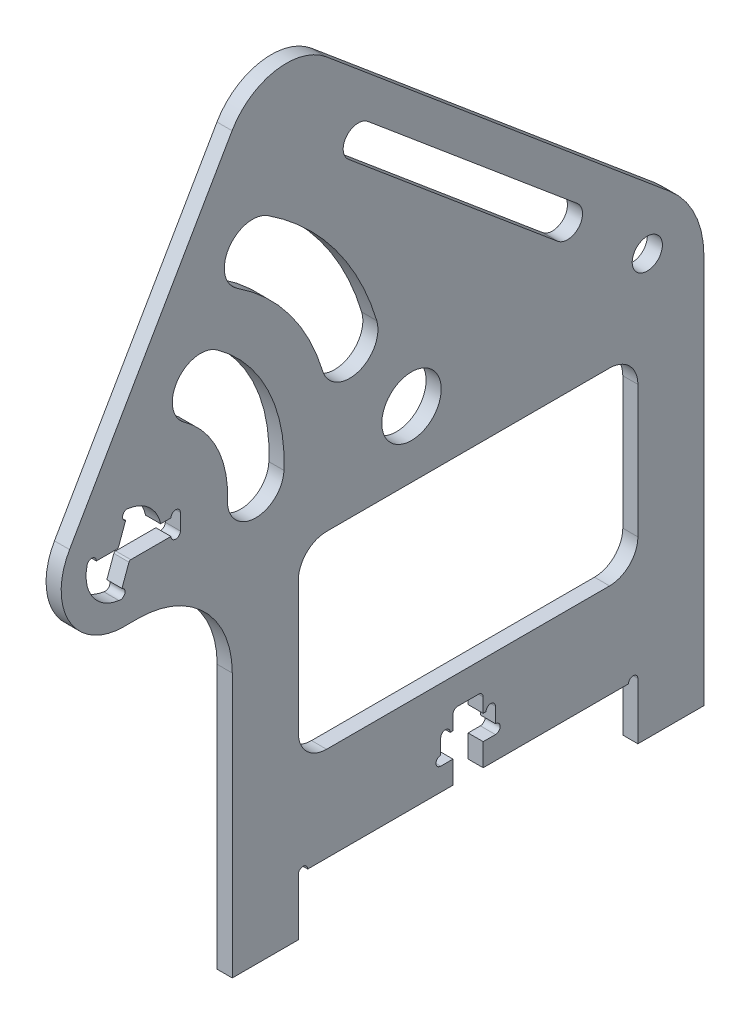
from build123d import *

# Parameters (mm, degrees)
MAIN_BODY_DEPTH                     = 0.8
SLOT_TABS_REACH                     = 94.146
SKETCH2_W                           = 7
SKETCH2_H                           = 6
SLOT_TABS_DIRECTION_2_REACH         = 94.146
ATTACHMENT_T_SLOT_DEPTH             = 93.146279065
ATTACHMENT_T_SLOT_DEPTH_BACK        = 93.146279065
SKETCH5_R                           = 1.6
CAMERA_SLOT_AND_STANDOFF_HOLE_DEPTH = 93.156696694
SKETCH6_R                           = 4
CAMERA_PLATE_HOLE_DEPTH             = 93.156696694
SKETCH9_W                           = 4
SKETCH9_H                           = 1.7
CAMERA_PLATE_SLOT_DEPTH             = 93.156696694
ANGLE_GUARD_DEPTH                   = 1.6
SKETCH7_W                           = 36
SKETCH7_H                           = 20
CUT_EXTRUDE4_DEPTH                  = 93.156696694
CAMERA_PLATE_HOLE_EASE_R            = 0.2
ACCESS_HOLE_FILLET_R                = 3
SECONDARY_FILLET_R                  = 10
CAMERA_EDGE_FILLET_R                = 6.639528096
SKETCH8_R                           = 3.15
TX_MOUNT_HOLE_DEPTH                 = 87.640768077
CUT_EXTRUDE5_REACH                  = 88.641
SKETCH14_R                          = 0.5
CUT_EXTRUDE6_REACH                  = 88.641


with BuildPart() as part:
    # Sketch1 → main body (new, symmetric)
    with BuildSketch(Plane(origin=(0, 0, 0), x_dir=(0, 0, -1), z_dir=(1, 0, 0))):
        Polygon((-25, 0), (25, 0), (25, 40), (-21.064869316, 78.653014853), (-48, 32), (-25, 32), align=None)
    extrude(amount=MAIN_BODY_DEPTH, both=True)

    # slot tabs: up to this face of the body (flat: up to its plane)
    slot_tabs_end = Plane(part.part.faces().sort_by_distance((0.8, 33.215216507, 6.663009482))[0])
    # Sketch2 → slot tabs (add, up to the picked face)
    with BuildSketch(Plane(origin=(0, 0, 0), x_dir=(0, 0, -1), z_dir=(1, 0, 0)), mode=Mode.PRIVATE) as slot_tabs_sk1:
        with Locations((-21.5, -3)):
            Rectangle(SKETCH2_W, SKETCH2_H)
    slot_tabs_tool1 = split(extrude(slot_tabs_sk1.sketch, amount=SLOT_TABS_REACH, mode=Mode.PRIVATE), bisect_by=slot_tabs_end, keep=Keep.BOTH, mode=Mode.PRIVATE)
    # Sketch2 → slot tabs (add, up to the picked face)
    with BuildSketch(Plane(origin=(0, 0, 0), x_dir=(0, 0, -1), z_dir=(1, 0, 0)), mode=Mode.PRIVATE) as slot_tabs_sk2:
        with Locations((21.5, -3)):
            Rectangle(SKETCH2_W, SKETCH2_H)
    slot_tabs_tool2 = split(extrude(slot_tabs_sk2.sketch, amount=SLOT_TABS_REACH, mode=Mode.PRIVATE), bisect_by=slot_tabs_end, keep=Keep.BOTH, mode=Mode.PRIVATE)
    add(slot_tabs_tool1.solids().sort_by(Axis((0, -3, 21.5), (1, 0, 0)))[0])
    add(slot_tabs_tool2.solids().sort_by(Axis((0, -3, -21.5), (1, 0, 0)))[0])

    # slot tabs direction 2: up to this face of the body (flat: up to its plane)
    slot_tabs_direction_2_end = Plane(part.part.faces().sort_by_distance((-0.8, 33.215216507, 6.663009482))[0])
    # Sketch2 → slot tabs direction 2 (add, up to the picked face)
    with BuildSketch(Plane(origin=(0, 0, 0), x_dir=(0, 0, -1), z_dir=(1, 0, 0)), mode=Mode.PRIVATE) as slot_tabs_direction_2_sk1:
        with Locations((-21.5, -3)):
            Rectangle(SKETCH2_W, SKETCH2_H)
    slot_tabs_direction_2_tool1 = split(extrude(slot_tabs_direction_2_sk1.sketch, amount=-SLOT_TABS_DIRECTION_2_REACH, mode=Mode.PRIVATE), bisect_by=slot_tabs_direction_2_end, keep=Keep.BOTH, mode=Mode.PRIVATE)
    # Sketch2 → slot tabs direction 2 (add, up to the picked face)
    with BuildSketch(Plane(origin=(0, 0, 0), x_dir=(0, 0, -1), z_dir=(1, 0, 0)), mode=Mode.PRIVATE) as slot_tabs_direction_2_sk2:
        with Locations((21.5, -3)):
            Rectangle(SKETCH2_W, SKETCH2_H)
    slot_tabs_direction_2_tool2 = split(extrude(slot_tabs_direction_2_sk2.sketch, amount=-SLOT_TABS_DIRECTION_2_REACH, mode=Mode.PRIVATE), bisect_by=slot_tabs_direction_2_end, keep=Keep.BOTH, mode=Mode.PRIVATE)
    add(slot_tabs_direction_2_tool1.solids().sort_by(Axis((0, -3, 21.5), (-1, 0, 0)))[0])
    add(slot_tabs_direction_2_tool2.solids().sort_by(Axis((0, -3, -21.5), (-1, 0, 0)))[0])

    # Sketch3 → attachment t-slot (cut, two sides: drawn at the far end of the back side and taken through both)
    with BuildSketch(Plane(origin=(0, 0, 0), x_dir=(0, 0, -1), z_dir=(1, 0, 0)).offset(-ATTACHMENT_T_SLOT_DEPTH_BACK)):
        Polygon((-1.6, 2.4), (-1.6, 0), (1.6, 0), (1.6, 2.4), (2.9, 2.4), (2.9, 5), (-2.9, 5), (-2.9, 2.4), align=None)
    extrude(amount=ATTACHMENT_T_SLOT_DEPTH + ATTACHMENT_T_SLOT_DEPTH_BACK, mode=Mode.SUBTRACT)

    # Sketch5 → camera slot and standoff hole (cut, through all)
    with BuildSketch(Plane(origin=(0.8, 0, 0), x_dir=(0, 0, -1), z_dir=(1, 0, 0))):
        with Locations((19, 38.50756134)):
            Circle(SKETCH5_R)
        with BuildLine():
            Line((-10.613317549, 65.444736837), (11.562427184, 46.83707761))
            ThreePointArc((11.562427184, 46.83707761), (11.759638118, 44.582946325), (9.505506833, 44.385735392))
            Line((9.505506833, 44.385735392), (-12.6702379, 62.993394619))
            ThreePointArc((-12.6702379, 62.993394619), (-12.867448834, 65.247525903), (-10.613317549, 65.444736837))
        make_face()
    extrude(amount=-CAMERA_SLOT_AND_STANDOFF_HOLE_DEPTH, mode=Mode.SUBTRACT)

    # Sketch6 → camera plate hole (cut, through all)
    with BuildSketch(Plane(origin=(0.8, 0, 0), x_dir=(0, 0, -1), z_dir=(1, 0, 0))):
        with Locations((-36.5, 38.639528096)):
            Circle(SKETCH6_R)
    extrude(amount=-CAMERA_PLATE_HOLE_DEPTH, mode=Mode.SUBTRACT)

    # Sketch9 → camera plate slot (cut, through all)
    with BuildSketch(Plane(origin=(0.8, 0, 0), x_dir=(0, 0, -1), z_dir=(1, 0, 0))):
        with Locations((-32.5, 38.639528096)):
            Rectangle(SKETCH9_W, SKETCH9_H)
    extrude(amount=-CAMERA_PLATE_SLOT_DEPTH, mode=Mode.SUBTRACT)

    # Sketch11 → angle guard (add)
    with BuildSketch(Plane(origin=(0.8, 0, 0), x_dir=(0, 0, -1), z_dir=(1, 0, 0))):
        with BuildLine():
            Line((-40.408644266, 39.489528096), (-37.095176407, 39.489528096))
            Line((-37.095176407, 39.489528096), (-35.961903656, 42.603169392))
            ThreePointArc((-35.961903656, 42.603169392), (-38.794305745, 41.916136273), (-40.408644266, 39.489528096))
        make_face()
        with BuildLine():
            ThreePointArc((-37.038096344, 34.6758868), (-34.205694255, 35.362919919), (-32.591355734, 37.789528096))
            Line((-32.591355734, 37.789528096), (-35.904823593, 37.789528096))
            Line((-35.904823593, 37.789528096), (-37.038096344, 34.6758868))
        make_face()
    extrude(amount=-ANGLE_GUARD_DEPTH)

    # Sketch7 → Cut-Extrude4 (cut, through all)
    with BuildSketch(Plane(origin=(0.8, 0, 0), x_dir=(0, 0, -1), z_dir=(1, 0, 0))):
        with Locations((0, 20)):
            Rectangle(SKETCH7_W, SKETCH7_H)
    extrude(amount=-CUT_EXTRUDE4_DEPTH, mode=Mode.SUBTRACT)

    # camera plate hole ease
    camera_plate_hole_ease_edges = [part.edges().sort_by_distance(p)[0] for p in [
        (0, 39.489528096, 37.095176407),
        (0, 37.789528096, 35.904823593),
    ]]
    fillet(camera_plate_hole_ease_edges, radius=CAMERA_PLATE_HOLE_EASE_R)

    # access hole fillet
    access_hole_fillet_edges = [part.edges().sort_by_distance(p)[0] for p in [
        (0, 10, 18),
        (0, 30, 18),
        (0, 30, -18),
        (0, 10, -18),
    ]]
    fillet(access_hole_fillet_edges, radius=ACCESS_HOLE_FILLET_R)

    # secondary fillet
    secondary_fillet_edges = [part.edges().sort_by_distance(p)[0] for p in [
        (0, 32, 25),
        (0, 40, -25),
    ]]
    fillet(secondary_fillet_edges, radius=SECONDARY_FILLET_R)

    # camera edge fillet
    camera_edge_fillet_edges = [part.edges().sort_by_distance(p)[0] for p in [
        (0, 32, 48),
        (0, 78.653014853, 21.064869316),
    ]]
    fillet(camera_edge_fillet_edges, radius=CAMERA_EDGE_FILLET_R)

    # Sketch8 → TX mount hole (cut, through all)
    with BuildSketch(Plane(origin=(0.8, 0, 0), x_dir=(0, 0, -1), z_dir=(1, 0, 0))):
        with Locations((-6, 37)):
            Circle(SKETCH8_R)
    extrude(amount=-TX_MOUNT_HOLE_DEPTH, mode=Mode.SUBTRACT)

    # Sketch14 → Cut-Extrude5 (cut, up to next)
    with BuildSketch(Plane(origin=(0.8, 0, 0), x_dir=(0, 0, -1), z_dir=(1, 0, 0)), mode=Mode.PRIVATE) as cut_extrude5_sk1:
        with Locations((-2.4, 5)):
            Circle(SKETCH14_R)
    cut_extrude5_tool1 = extrude(cut_extrude5_sk1.sketch, amount=-CUT_EXTRUDE5_REACH, mode=Mode.PRIVATE) & part.part
    # Sketch14 → Cut-Extrude5 (cut, up to next)
    with BuildSketch(Plane(origin=(0.8, 0, 0), x_dir=(0, 0, -1), z_dir=(1, 0, 0)), mode=Mode.PRIVATE) as cut_extrude5_sk2:
        with Locations((2.4, 5)):
            Circle(SKETCH14_R)
    cut_extrude5_tool2 = extrude(cut_extrude5_sk2.sketch, amount=-CUT_EXTRUDE5_REACH, mode=Mode.PRIVATE) & part.part
    # Sketch14 → Cut-Extrude5 (cut, up to next)
    with BuildSketch(Plane(origin=(0.8, 0, 0), x_dir=(0, 0, -1), z_dir=(1, 0, 0)), mode=Mode.PRIVATE) as cut_extrude5_sk3:
        with Locations((2.9, 2.9)):
            Circle(SKETCH14_R)
    cut_extrude5_tool3 = extrude(cut_extrude5_sk3.sketch, amount=-CUT_EXTRUDE5_REACH, mode=Mode.PRIVATE) & part.part
    # Sketch14 → Cut-Extrude5 (cut, up to next)
    with BuildSketch(Plane(origin=(0.8, 0, 0), x_dir=(0, 0, -1), z_dir=(1, 0, 0)), mode=Mode.PRIVATE) as cut_extrude5_sk4:
        with Locations((-2.9, 2.9)):
            Circle(SKETCH14_R)
    cut_extrude5_tool4 = extrude(cut_extrude5_sk4.sketch, amount=-CUT_EXTRUDE5_REACH, mode=Mode.PRIVATE) & part.part
    # Sketch14 → Cut-Extrude5 (cut, up to next)
    with BuildSketch(Plane(origin=(0.8, 0, 0), x_dir=(0, 0, -1), z_dir=(1, 0, 0)), mode=Mode.PRIVATE) as cut_extrude5_sk5:
        with Locations((-17.5, 0)):
            Circle(SKETCH14_R)
    cut_extrude5_tool5 = extrude(cut_extrude5_sk5.sketch, amount=-CUT_EXTRUDE5_REACH, mode=Mode.PRIVATE) & part.part
    # Sketch14 → Cut-Extrude5 (cut, up to next)
    with BuildSketch(Plane(origin=(0.8, 0, 0), x_dir=(0, 0, -1), z_dir=(1, 0, 0)), mode=Mode.PRIVATE) as cut_extrude5_sk6:
        with Locations((17.5, 0)):
            Circle(SKETCH14_R)
    cut_extrude5_tool6 = extrude(cut_extrude5_sk6.sketch, amount=-CUT_EXTRUDE5_REACH, mode=Mode.PRIVATE) & part.part
    # Sketch14 → Cut-Extrude5 (cut, up to next)
    with BuildSketch(Plane(origin=(0.8, 0, 0), x_dir=(0, 0, -1), z_dir=(1, 0, 0)), mode=Mode.PRIVATE) as cut_extrude5_sk7:
        with Locations((-36.132913727, 42.133323081)):
            Circle(SKETCH14_R)
    cut_extrude5_tool7 = extrude(cut_extrude5_sk7.sketch, amount=-CUT_EXTRUDE5_REACH, mode=Mode.PRIVATE) & part.part
    # Sketch14 → Cut-Extrude5 (cut, up to next)
    with BuildSketch(Plane(origin=(0.8, 0, 0), x_dir=(0, 0, -1), z_dir=(1, 0, 0)), mode=Mode.PRIVATE) as cut_extrude5_sk8:
        with Locations((-39.908644266, 39.489528096)):
            Circle(SKETCH14_R)
    cut_extrude5_tool8 = extrude(cut_extrude5_sk8.sketch, amount=-CUT_EXTRUDE5_REACH, mode=Mode.PRIVATE) & part.part
    # Sketch14 → Cut-Extrude5 (cut, up to next)
    with BuildSketch(Plane(origin=(0.8, 0, 0), x_dir=(0, 0, -1), z_dir=(1, 0, 0)), mode=Mode.PRIVATE) as cut_extrude5_sk9:
        with Locations((-36.867086273, 35.14573311)):
            Circle(SKETCH14_R)
    cut_extrude5_tool9 = extrude(cut_extrude5_sk9.sketch, amount=-CUT_EXTRUDE5_REACH, mode=Mode.PRIVATE) & part.part
    # Sketch14 → Cut-Extrude5 (cut, up to next)
    with BuildSketch(Plane(origin=(0.8, 0, 0), x_dir=(0, 0, -1), z_dir=(1, 0, 0)), mode=Mode.PRIVATE) as cut_extrude5_sk10:
        with Locations((-31, 37.789528096)):
            Circle(SKETCH14_R)
    cut_extrude5_tool10 = extrude(cut_extrude5_sk10.sketch, amount=-CUT_EXTRUDE5_REACH, mode=Mode.PRIVATE) & part.part
    # Sketch14 → Cut-Extrude5 (cut, up to next)
    with BuildSketch(Plane(origin=(0.8, 0, 0), x_dir=(0, 0, -1), z_dir=(1, 0, 0)), mode=Mode.PRIVATE) as cut_extrude5_sk11:
        with Locations((-31, 39.489528096)):
            Circle(SKETCH14_R)
    cut_extrude5_tool11 = extrude(cut_extrude5_sk11.sketch, amount=-CUT_EXTRUDE5_REACH, mode=Mode.PRIVATE) & part.part
    # Sketch14 → Cut-Extrude5 (cut, up to next)
    with BuildSketch(Plane(origin=(0.8, 0, 0), x_dir=(0, 0, -1), z_dir=(1, 0, 0)), mode=Mode.PRIVATE) as cut_extrude5_sk12:
        with BuildLine():
            Line((-1.1, 7), (1.1, 7))
            ThreePointArc((1.1, 7), (1.453553391, 6.853553391), (1.6, 6.5))
            Line((1.6, 6.5), (1.6, 5))
            ThreePointArc((1.6, 5), (0, 3.4), (-1.6, 5))
            Line((-1.6, 5), (-1.6, 6.5))
            ThreePointArc((-1.6, 6.5), (-1.453553391, 6.853553391), (-1.1, 7))
        make_face()
    cut_extrude5_tool12 = extrude(cut_extrude5_sk12.sketch, amount=-CUT_EXTRUDE5_REACH, mode=Mode.PRIVATE) & part.part
    add(cut_extrude5_tool1.solids().sort_by_distance((0.8, 5, 2.4))[0], mode=Mode.SUBTRACT)
    add(cut_extrude5_tool2.solids().sort_by_distance((0.8, 5, -2.4))[0], mode=Mode.SUBTRACT)
    add(cut_extrude5_tool3.solids().sort_by_distance((0.8, 2.9, -2.9))[0], mode=Mode.SUBTRACT)
    add(cut_extrude5_tool4.solids().sort_by_distance((0.8, 2.9, 2.9))[0], mode=Mode.SUBTRACT)
    add(cut_extrude5_tool5.solids().sort_by_distance((0.8, 0, 17.5))[0], mode=Mode.SUBTRACT)
    add(cut_extrude5_tool6.solids().sort_by_distance((0.8, 0, -17.5))[0], mode=Mode.SUBTRACT)
    add(cut_extrude5_tool7.solids().sort_by_distance((0.8, 42.133323, 36.132914))[0], mode=Mode.SUBTRACT)
    add(cut_extrude5_tool8.solids().sort_by_distance((0.8, 39.489528, 39.908644))[0], mode=Mode.SUBTRACT)
    add(cut_extrude5_tool9.solids().sort_by_distance((0.8, 35.145733, 36.867086))[0], mode=Mode.SUBTRACT)
    add(cut_extrude5_tool10.solids().sort_by_distance((0.8, 37.789528, 31))[0], mode=Mode.SUBTRACT)
    add(cut_extrude5_tool11.solids().sort_by_distance((0.8, 39.489528, 31))[0], mode=Mode.SUBTRACT)
    add(cut_extrude5_tool12.solids().sort_by_distance((0.8, 5.336119, 0))[0], mode=Mode.SUBTRACT)

    # Sketch15 → Cut-Extrude6 (cut, up to next)
    with BuildSketch(Plane(origin=(0.8, 0, 0), x_dir=(0, 0, -1), z_dir=(1, 0, 0)), mode=Mode.PRIVATE) as cut_extrude6_sk1:
        with BuildLine():
            ThreePointArc((-19.517746342, 37.862958265), (-21.207853248, 46.065849373), (-26.609553808, 52.466280213))
            ThreePointArc((-26.609553808, 52.466280213), (-30.794941745, 51.771637991), (-30.100299523, 47.586250054))
            ThreePointArc((-30.100299523, 47.586250054), (-26.605081513, 43.444794805), (-25.511482927, 38.137041735))
            ThreePointArc((-25.511482927, 38.137041735), (-22.65165637, 35.003131707), (-19.517746342, 37.862958265))
        make_face()
    cut_extrude6_tool1 = extrude(cut_extrude6_sk1.sketch, amount=-CUT_EXTRUDE6_REACH, mode=Mode.PRIVATE) & part.part
    # Sketch15 → Cut-Extrude6 (cut, up to next)
    with BuildSketch(Plane(origin=(0.8, 0, 0), x_dir=(0, 0, -1), z_dir=(1, 0, 0)), mode=Mode.PRIVATE) as cut_extrude6_sk2:
        with BuildLine():
            ThreePointArc((-9.683842766, 46.695191395), (-14.07965784, 55.41237095), (-21.201157651, 62.090443276))
            ThreePointArc((-21.201157651, 62.090443276), (-25.352917386, 61.217006901), (-24.479481011, 57.065247166))
            ThreePointArc((-24.479481011, 57.065247166), (-18.884016874, 51.818190338), (-15.430162173, 44.968977831))
            ThreePointArc((-15.430162173, 44.968977831), (-11.693895687, 42.95892491), (-9.683842766, 46.695191395))
        make_face()
    cut_extrude6_tool2 = extrude(cut_extrude6_sk2.sketch, amount=-CUT_EXTRUDE6_REACH, mode=Mode.PRIVATE) & part.part
    add(cut_extrude6_tool1.solids().sort_by_distance((0.8, 44.381365, 24.676513))[0], mode=Mode.SUBTRACT)
    add(cut_extrude6_tool2.solids().sort_by_distance((0.8, 53.182243, 17.060681))[0], mode=Mode.SUBTRACT)


solid = part.part
